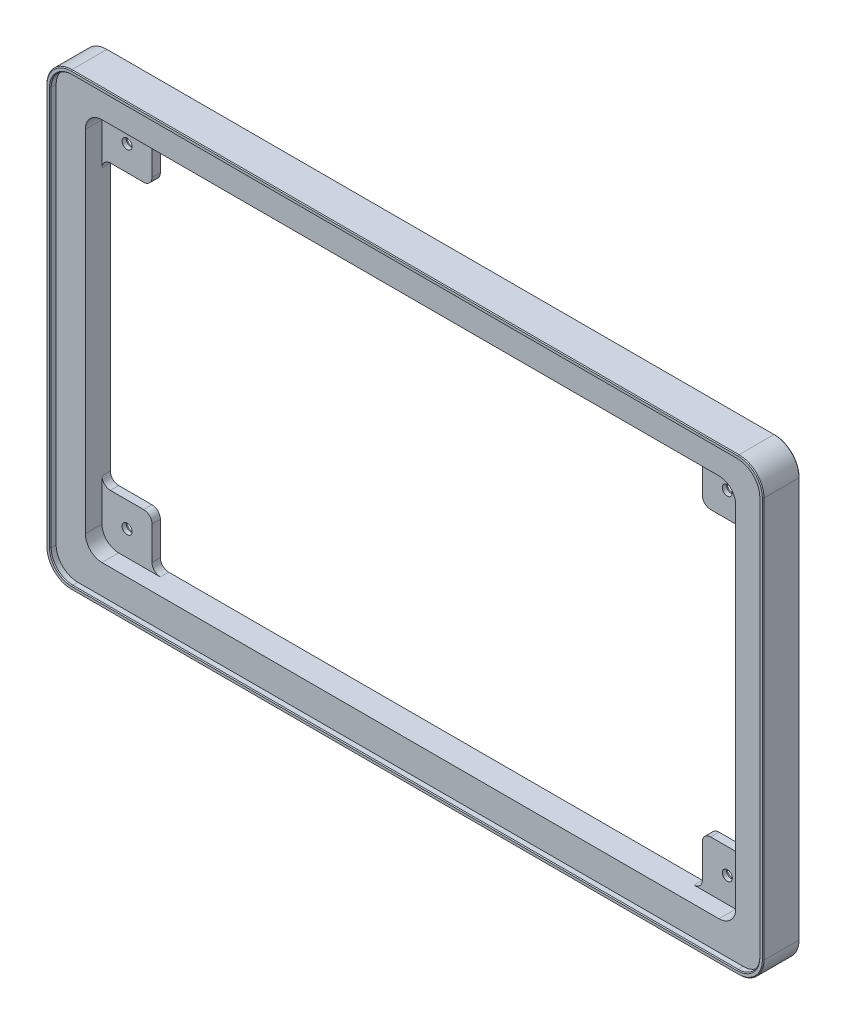
from build123d import *

# Parameters (mm, degrees)
EXTRUDE_1_DEPTH     = 4.4
CUT_EXTRUDE_1_DEPTH = 4.4
EXTRUDE_START       = -0.7
EXTRUDE_2_DEPTH     = 3
CUT_EXTRUDE_2_DEPTH = 3
SKETCH_7_W          = 6
SKETCH_7_H          = 6
EXTRUDE_4_DEPTH     = 1
FILLET_1_R          = 1
SKETCH_8_R          = 0.6
CUT_EXTRUDE_3_DEPTH = 1
CHAMFER_1_SIZE      = 0.1
SKETCH_9_R          = 1.1
CUT_EXTRUDE_4_DEPTH = 0.5


with BuildPart() as part:
    # Эскиз1 → Бобышка-Вытянуть1 (new body)
    with BuildSketch(Plane.XY):
        with BuildLine():
            Line((-40, 27), (40, 27))
            ThreePointArc((40, 27), (42.121320344, 26.121320344), (43, 24))
            Line((43, 24), (43, -24))
            ThreePointArc((43, -24), (42.121320344, -26.121320344), (40, -27))
            Line((40, -27), (-40, -27))
            ThreePointArc((-40, -27), (-42.121320344, -26.121320344), (-43, -24))
            Line((-43, -24), (-43, 24))
            ThreePointArc((-43, 24), (-42.121320344, 26.121320344), (-40, 27))
        make_face()
    extrude(amount=EXTRUDE_1_DEPTH)

    # Эскиз2 → Вырез-Вытянуть1 (cut)
    with BuildSketch(Plane.XY.offset(4.4)):
        with BuildLine():
            Line((-39.9, 26.5), (39.9, 26.5))
            ThreePointArc((39.9, 26.5), (41.738477631, 25.738477631), (42.5, 23.9))
            Line((42.5, 23.9), (42.5, -23.9))
            ThreePointArc((42.5, -23.9), (41.738477631, -25.738477631), (39.9, -26.5))
            Line((39.9, -26.5), (-39.9, -26.5))
            ThreePointArc((-39.9, -26.5), (-41.738477631, -25.738477631), (-42.5, -23.9))
            Line((-42.5, -23.9), (-42.5, 23.9))
            ThreePointArc((-42.5, 23.9), (-41.738477631, 25.738477631), (-39.9, 26.5))
        make_face()
    extrude(amount=-CUT_EXTRUDE_1_DEPTH, mode=Mode.SUBTRACT)

    # Эскиз4 → Бобышка-Вытянуть2 (add)
    with BuildSketch(Plane.XY.offset(4.4).offset(EXTRUDE_START)):
        with BuildLine():
            Line((-39.9, 26.5), (39.9, 26.5))
            ThreePointArc((39.9, 26.5), (41.738477631, 25.738477631), (42.5, 23.9))
            Line((42.5, 23.9), (42.5, -23.9))
            ThreePointArc((42.5, -23.9), (41.738477631, -25.738477631), (39.9, -26.5))
            Line((39.9, -26.5), (-39.9, -26.5))
            ThreePointArc((-39.9, -26.5), (-41.738477631, -25.738477631), (-42.5, -23.9))
            Line((-42.5, -23.9), (-42.5, 23.9))
            ThreePointArc((-42.5, 23.9), (-41.738477631, 25.738477631), (-39.9, 26.5))
        make_face()
    extrude(amount=-EXTRUDE_2_DEPTH)

    # Эскиз5 → Вырез-Вытянуть2 (cut)
    with BuildSketch(Plane.XY.offset(3.7)):
        with BuildLine():
            Line((-37, 23), (37, 23))
            ThreePointArc((37, 23), (38.414213562, 22.414213562), (39, 21))
            Line((39, 21), (39, -21))
            ThreePointArc((39, -21), (38.414213562, -22.414213562), (37, -23))
            Line((37, -23), (-37, -23))
            ThreePointArc((-37, -23), (-38.414213562, -22.414213562), (-39, -21))
            Line((-39, -21), (-39, 21))
            ThreePointArc((-39, 21), (-38.414213562, 22.414213562), (-37, 23))
        make_face()
    extrude(amount=-CUT_EXTRUDE_2_DEPTH, mode=Mode.SUBTRACT)

    # Эскиз7 → Бобышка-Вытянуть4 (add)
    with BuildSketch(Plane(origin=(0, 0, 0.7), x_dir=(-1, 0, 0), z_dir=(0, 0, -1))):
        with Locations((-36, 20)):
            Rectangle(SKETCH_7_W, SKETCH_7_H)
        with Locations((36, 20)):
            Rectangle(SKETCH_7_W, SKETCH_7_H)
        with Locations((36, -20)):
            Rectangle(SKETCH_7_W, SKETCH_7_H)
        with Locations((-36, -20)):
            Rectangle(SKETCH_7_W, SKETCH_7_H)
    extrude(amount=-EXTRUDE_4_DEPTH)

    # Скругление1
    fillet_1_edges = [part.edges().sort_by_distance(p)[0] for p in [
        (39, 17, 1.2),
        (33, 23, 1.2),
        (33, 17, 1.2),
        (-39, -17, 1.2),
        (-33, -23, 1.2),
        (-33, -17, 1.2),
        (-33, 23, 1.2),
        (-39, 17, 1.2),
        (-33, 17, 1.2),
        (33, -23, 1.2),
        (39, -17, 1.2),
        (33, -17, 1.2),
    ]]
    fillet(fillet_1_edges, radius=FILLET_1_R)

    # Эскиз8 → Вырез-Вытянуть3 (cut)
    with BuildSketch(Plane(origin=(0, 0, 0.7), x_dir=(-1, 0, 0), z_dir=(0, 0, -1))):
        with Locations((-36, 20)):
            Circle(SKETCH_8_R)
        with Locations((36, 20)):
            Circle(SKETCH_8_R)
        with Locations((36, -20)):
            Circle(SKETCH_8_R)
        with Locations((-36, -20)):
            Circle(SKETCH_8_R)
    extrude(amount=-CUT_EXTRUDE_3_DEPTH, mode=Mode.SUBTRACT)

    # Фаска1
    chamfer_1_edges = [part.edges().sort_by_distance(p)[0] for p in [
        (43, 0, 0),
        (42.121320344, -26.121320344, 0),
        (0, -27, 0),
        (-42.121320344, -26.121320344, 0),
        (42.121320344, -26.121320344, 4.4),
        (43, 0, 4.4),
        (42.121320344, 26.121320344, 4.4),
        (0, 27, 4.4),
        (-42.121320344, 26.121320344, 4.4),
        (-43, 0, 4.4),
        (-41.738477631, 25.738477631, 0),
        (0, 26.5, 0),
        (41.738477631, 25.738477631, 0),
        (42.5, 0, 0),
        (41.738477631, -25.738477631, 0),
        (0, -26.5, 0),
        (-41.738477631, -25.738477631, 0),
        (-42.5, 0, 0),
        (-41.738477631, 25.738477631, 4.4),
        (-42.5, 0, 4.4),
        (-41.738477631, -25.738477631, 4.4),
        (0, -26.5, 4.4),
        (41.738477631, -25.738477631, 4.4),
        (42.5, 0, 4.4),
        (41.738477631, 25.738477631, 4.4),
        (0, 26.5, 4.4),
        (-42.121320344, -26.121320344, 4.4),
        (-43, 0, 0),
        (0, -27, 4.4),
        (-42.121320344, 26.121320344, 0),
        (0, 27, 0),
        (42.121320344, 26.121320344, 0),
    ]]
    chamfer(chamfer_1_edges, length=CHAMFER_1_SIZE)

    # Эскиз9 → Вырез-Вытянуть4 (cut)
    with BuildSketch(Plane(origin=(0, 0, 0.7), x_dir=(-1, 0, 0), z_dir=(0, 0, -1))):
        with Locations((36, 20)):
            Circle(SKETCH_9_R)
        with Locations((36, -20)):
            Circle(SKETCH_9_R)
        with Locations((-36, -20)):
            Circle(SKETCH_9_R)
        with Locations((-36, 20)):
            Circle(SKETCH_9_R)
    extrude(amount=-CUT_EXTRUDE_4_DEPTH, mode=Mode.SUBTRACT)


solid = part.part
